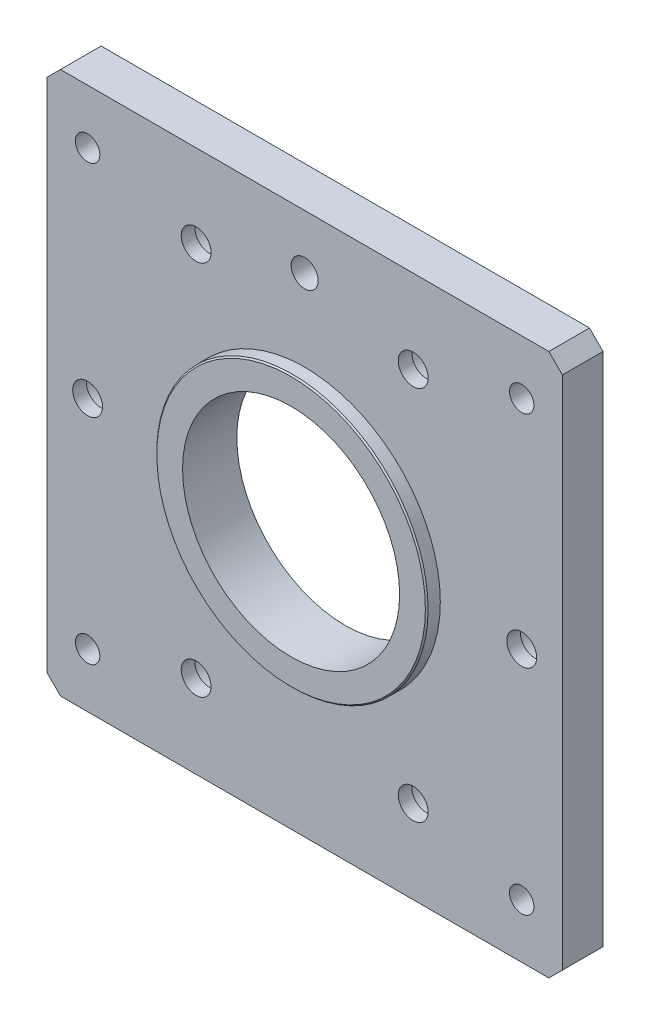
from build123d import *

# Parameters (mm, degrees)
CROQUIS1_W                                           = 190
CROQUIS1_H                                           = 200
CROQUIS1_R                                           = 5
CROQUIS1_R_2                                         = 40
SALIENTE_EXTRUIR1_DEPTH                              = 20
CROQUIS2_OUTSIDE_W                                   = 247.318
CROQUIS2_OUTSIDE_H                                   = 257.318
CROQUIS2_OUTSIDE_R                                   = 50
CORTAR_EXTRUIR1_DEPTH                                = 5
CHAFL_N1_SIZE                                        = 0.5
CHAFL_N2_SIZE                                        = 5
CORTAR_EXTRUIR2_DEPTH                                = 139.744369255
CORTAR_EXTRUIR2_DEPTH_BACK                           = 139.744369255
CROQUIS3_R                                           = 4.375
REFRENTADO_PARA_TORNILLO_TAP_N_CON_CABEZ_D           = 11
REFRENTADO_PARA_TORNILLO_TAP_N_CON_CABEZ_CBORE_D     = 18
REFRENTADO_PARA_TORNILLO_TAP_N_CON_CABEZ_CBORE_DEPTH = 10
TALADRO_ROSCADO_M10X1_01_D                           = 9


with BuildPart() as part:
    # Croquis1 → Saliente-Extruir1 (new body)
    with BuildSketch(Plane.XY):
        Rectangle(CROQUIS1_W, CROQUIS1_H)
        with Locations((80, 0)):
            Circle(CROQUIS1_R, mode=Mode.SUBTRACT)
        with Locations((40, -69.282032303)):
            Circle(CROQUIS1_R, mode=Mode.SUBTRACT)
        with Locations((-40, -69.282032303)):
            Circle(CROQUIS1_R, mode=Mode.SUBTRACT)
        with Locations((-80, 0)):
            Circle(CROQUIS1_R, mode=Mode.SUBTRACT)
        with Locations((-40, 69.282032303)):
            Circle(CROQUIS1_R, mode=Mode.SUBTRACT)
        with Locations((40, 69.282032303)):
            Circle(CROQUIS1_R, mode=Mode.SUBTRACT)
        with Locations((0, 80)):
            Circle(CROQUIS1_R, mode=Mode.SUBTRACT)
        Circle(CROQUIS1_R_2, mode=Mode.SUBTRACT)
    extrude(amount=SALIENTE_EXTRUIR1_DEPTH)

    # Croquis2 outside → Cortar-Extruir1 (cut)
    with BuildSketch(Plane.XY.offset(20)):
        Rectangle(CROQUIS2_OUTSIDE_W, CROQUIS2_OUTSIDE_H)
        Circle(CROQUIS2_OUTSIDE_R, mode=Mode.SUBTRACT)
    extrude(amount=-CORTAR_EXTRUIR1_DEPTH, mode=Mode.SUBTRACT)

    # Chaflán1
    chafl_n1_edges = [part.edges().sort_by_distance(p)[0] for p in [
        (-50, 0, 20),
    ]]
    chamfer(chafl_n1_edges, length=CHAFL_N1_SIZE)

    # Chaflán2
    chafl_n2_edges = [part.edges().sort_by_distance(p)[0] for p in [
        (95, -100, 7.5),
        (-95, -100, 7.5),
        (-95, 100, 7.5),
        (95, 100, 7.5),
    ]]
    chamfer(chafl_n2_edges, length=CHAFL_N2_SIZE)

    # Croquis3 → Cortar-Extruir2 (cut, two sides: drawn at the far end of the back side and taken through both)
    with BuildSketch(Plane.XY.offset(15).offset(-CORTAR_EXTRUIR2_DEPTH_BACK)):
        with Locations((-80, 80)):
            Circle(CROQUIS3_R)
        with Locations((80, 80)):
            Circle(CROQUIS3_R)
        with Locations((80, -80)):
            Circle(CROQUIS3_R)
        with Locations((-80, -80)):
            Circle(CROQUIS3_R)
    extrude(amount=CORTAR_EXTRUIR2_DEPTH + CORTAR_EXTRUIR2_DEPTH_BACK, mode=Mode.SUBTRACT)

    # Refrentado para tornillo tapón con cabeza de clavija de M101 (through all)
    with Locations(Plane(origin=(40, 69.282032303, 0), x_dir=(-1, 0, 0), z_dir=(0, 0, -1))):
        with Locations((0, 0), (-40, -69.282032303), (120, -69.282032303), (80, -138.564064606), (0, -138.564064606), (80, 0)):
            CounterBoreHole(REFRENTADO_PARA_TORNILLO_TAP_N_CON_CABEZ_D / 2, REFRENTADO_PARA_TORNILLO_TAP_N_CON_CABEZ_CBORE_D / 2, REFRENTADO_PARA_TORNILLO_TAP_N_CON_CABEZ_CBORE_DEPTH)

    # Taladro roscado M10x1.01 (through all)
    with Locations(Plane(origin=(0, 0, 0), x_dir=(-1, 0, 0), z_dir=(0, 0, -1))):
        with Locations((-80, 80), (80, 80), (-80, -80), (80, -80)):
            Hole(TALADRO_ROSCADO_M10X1_01_D / 2)


solid = part.part
